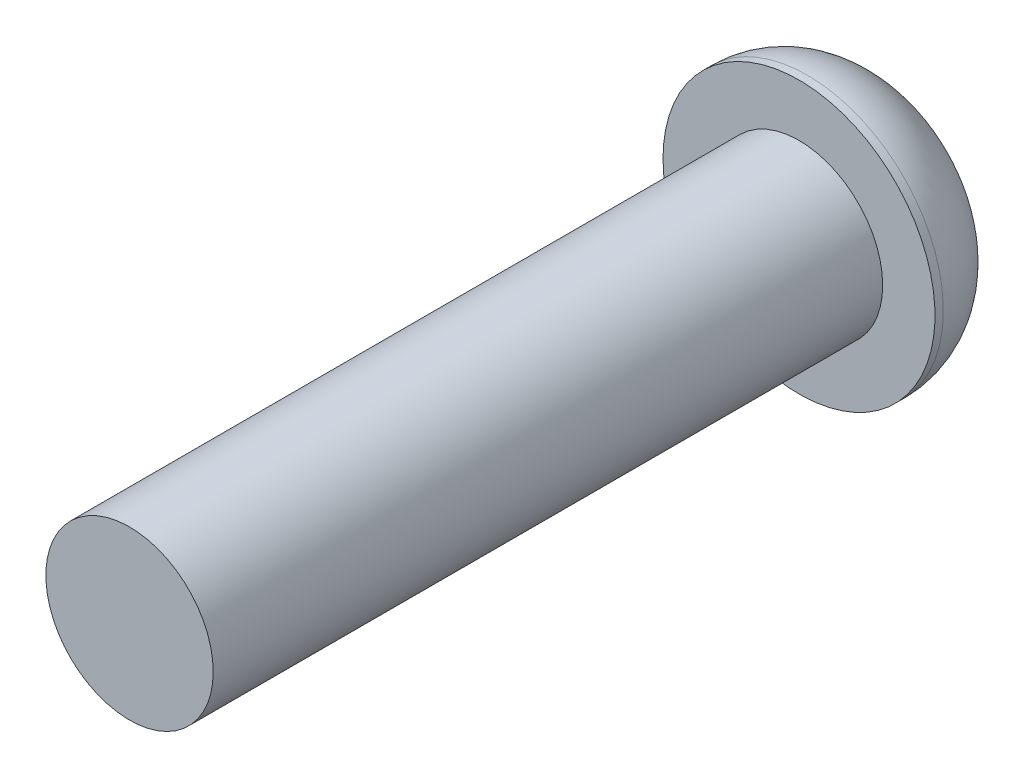
from build123d import *

# Parameters (mm, degrees)
SKETCH_1_R          = 2
EXTRUDE_1_DEPTH     = 16
SKETCH_2_R          = 3.25
EXTRUDE_2_DEPTH     = 2.2
FILLET_1_R          = 2
CUT_EXTRUDE_1_DEPTH = 0.5


with BuildPart() as part:
    # 草图1 → 凸台-拉伸1 (new body)
    with BuildSketch(Plane.XY):
        Circle(SKETCH_1_R)
    extrude(amount=EXTRUDE_1_DEPTH)

    # 草图2 → 凸台-拉伸2 (add)
    with BuildSketch(Plane(origin=(0, 0, 0), x_dir=(-1, 0, 0), z_dir=(0, 0, -1))):
        Circle(SKETCH_2_R)
    extrude(amount=EXTRUDE_2_DEPTH)

    # 圆角1
    fillet_1_edges = [part.edges().sort_by_distance(p)[0] for p in [
        (3.25, 0, -2.2),
    ]]
    fillet(fillet_1_edges, radius=FILLET_1_R)

    # 草图3 → 切除-拉伸1 (cut)
    with BuildSketch(Plane(origin=(0, 0, -2.2), x_dir=(-1, 0, 0), z_dir=(0, 0, -1))):
        Polygon((3.239974874, 0.25), (3.239974874, -0.25), (0.25, -0.25), (0.25, -3.239974874), (-0.25, -3.239974874), (-0.25, -0.25), (-3.239974874, -0.25), (-3.239974874, 0.25), (-0.25, 0.25), (-0.25, 3.239974874), (0.25, 3.239974874), (0.25, 0.25), align=None)
    extrude(amount=-CUT_EXTRUDE_1_DEPTH, mode=Mode.SUBTRACT)


solid = part.part
